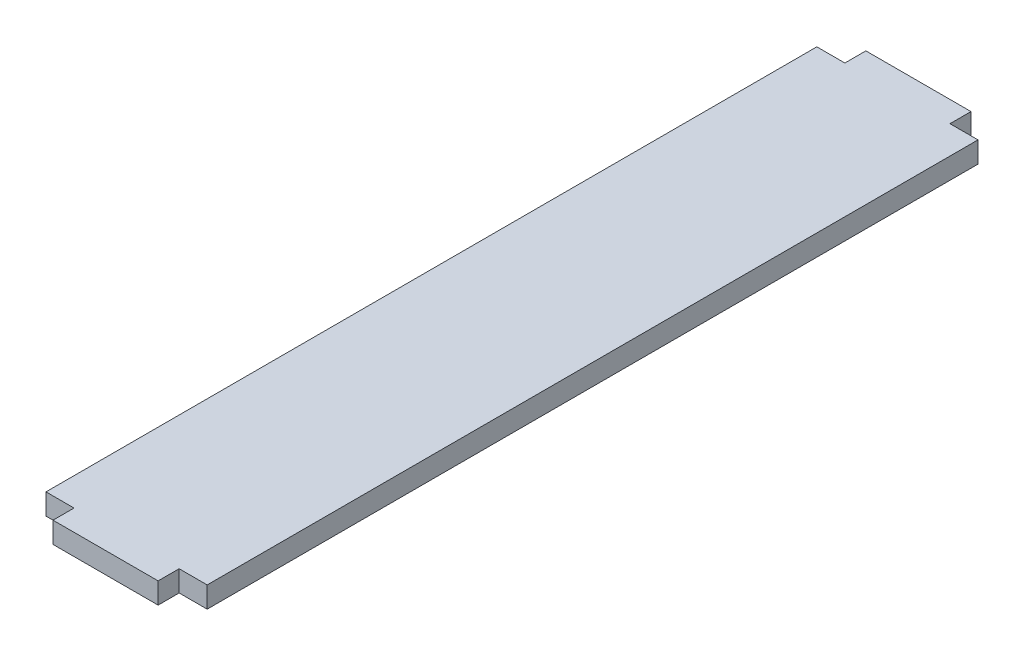
from build123d import *

# Parameters (mm, degrees)
BOSS_EXTRUDE1_DEPTH = 1.5


with BuildPart() as part:
    # Sketch1 → Boss-Extrude1 (new body)
    with BuildSketch(Plane(origin=(0, 0, 0), x_dir=(1, 0, 0), z_dir=(0, 1, 0))):
        Polygon((3.75, 27.5), (5.75, 27.5), (5.75, -12.4), (5.75, -14.1), (5.75, -27.5), (3.75, -27.5), (3.75, -29), (-3.75, -29), (-3.75, -27.5), (-5.75, -27.5), (-5.75, -19.1), (-5.75, -17.4), (-5.75, 27.5), (-3.75, 27.5), (-3.75, 29), (3.75, 29), align=None)
    extrude(amount=BOSS_EXTRUDE1_DEPTH)


solid = part.part
